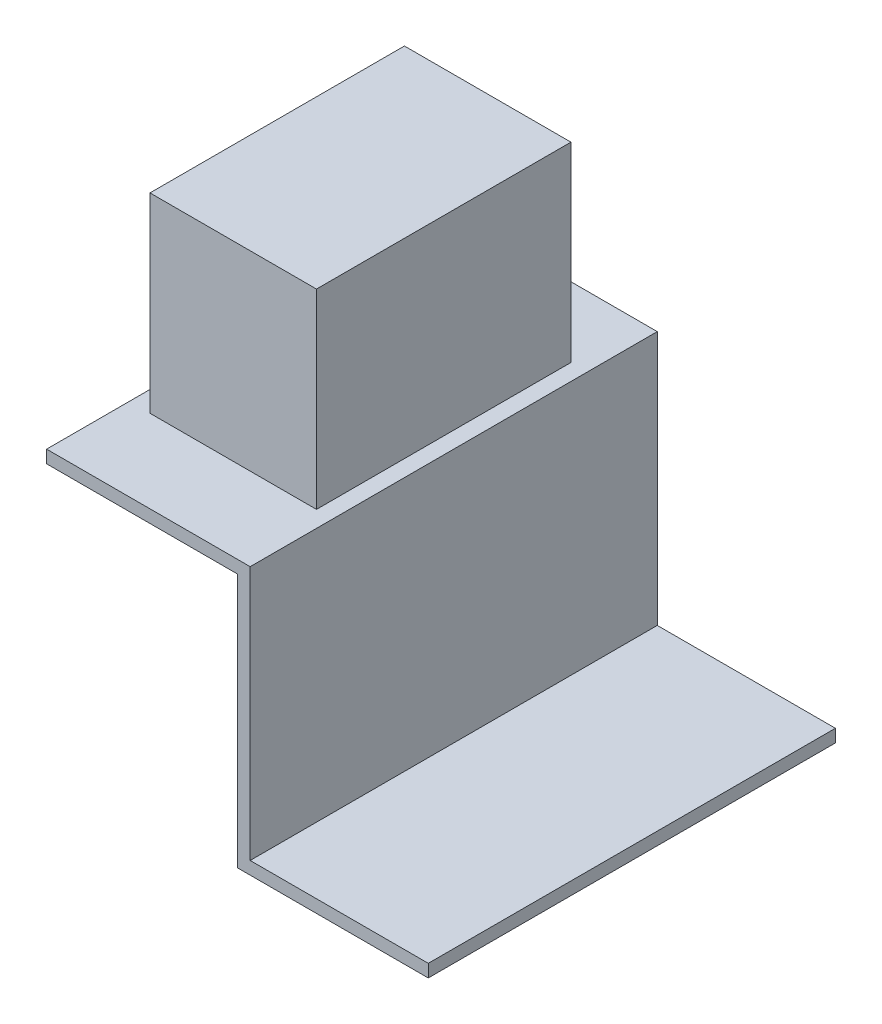
from build123d import *

# Parameters (mm, degrees)
SKETCH_1_W       = 15
SKETCH_1_H       = 32
EXTRUDE_1_DEPTH  = 1
SKETCH_2_W       = 1
SKETCH_2_H       = 32
EXTRUDE_2_DEPTH  = 20
SKETCH_8_W       = 32
SKETCH_8_H       = 1
EXTRUDE_8_DEPTH  = 15
SKETCH_9_W       = 13.087276504
SKETCH_9_H       = 20
EXTRUDE_9_DEPTH  = 15
SKETCH_10_R      = 2.796797866
EXTRUDE_10_DEPTH = 3


with BuildPart() as part:
    # 草图1 → 凸台-拉伸1 (new body)
    with BuildSketch(Plane(origin=(0, 0, 0), x_dir=(1, 0, 0), z_dir=(0, 1, 0))):
        Rectangle(SKETCH_1_W, SKETCH_1_H)
    extrude(amount=EXTRUDE_1_DEPTH)

    # 草图2 → 凸台-拉伸2 (add)
    with BuildSketch(Plane(origin=(0, 1, 0), x_dir=(1, 0, 0), z_dir=(0, 1, 0))):
        with Locations((-7, 0)):
            Rectangle(SKETCH_2_W, SKETCH_2_H)
    extrude(amount=EXTRUDE_2_DEPTH)

    # 草图8 → 凸台-拉伸8 (add)
    with BuildSketch(Plane.ZY.offset(7.5)):
        with Locations((0, 20.5)):
            Rectangle(SKETCH_8_W, SKETCH_8_H)
    extrude(amount=EXTRUDE_8_DEPTH)

    # 草图9 → 凸台-拉伸9 (add)
    with BuildSketch(Plane(origin=(0, 21, 0), x_dir=(1, 0, 0), z_dir=(0, 1, 0))):
        with Locations((-14.334681212, 0.503703775)):
            Rectangle(SKETCH_9_W, SKETCH_9_H)
    extrude(amount=EXTRUDE_9_DEPTH)

    # 草图10 → 凸台-拉伸10 (add)
    with BuildSketch(Plane.ZY.offset(20.878319464)):
        with Locations(Location((0, 28.5, 0), (0, 0, 180))):
            Circle(SKETCH_10_R)
    extrude(amount=EXTRUDE_10_DEPTH)


solid = part.part
